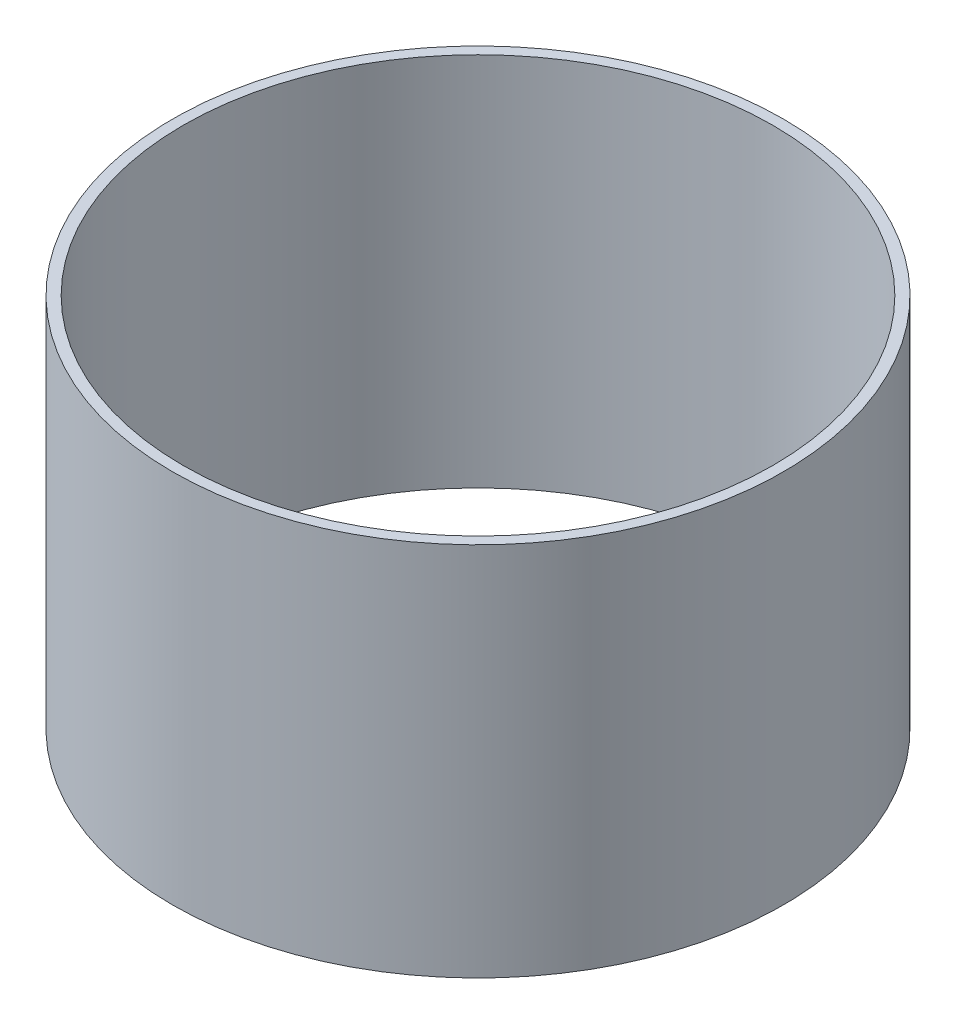
from build123d import *

# Parameters (mm, degrees)
SKETCH1_R           = 57
SKETCH1_R_2         = 55
BOSS_EXTRUDE1_DEPTH = 70


with BuildPart() as part:
    # Sketch1 → Boss-Extrude1 (new body)
    with BuildSketch(Plane(origin=(0, 0, 0), x_dir=(1, 0, 0), z_dir=(0, 1, 0))):
        with Locations(Location((0, 0, 0), (0, 0, 270))):
            Circle(SKETCH1_R)
        with Locations(Location((0, 0, 0), (0, 0, 270))):
            Circle(SKETCH1_R_2, mode=Mode.SUBTRACT)
    extrude(amount=BOSS_EXTRUDE1_DEPTH)


solid = part.part
